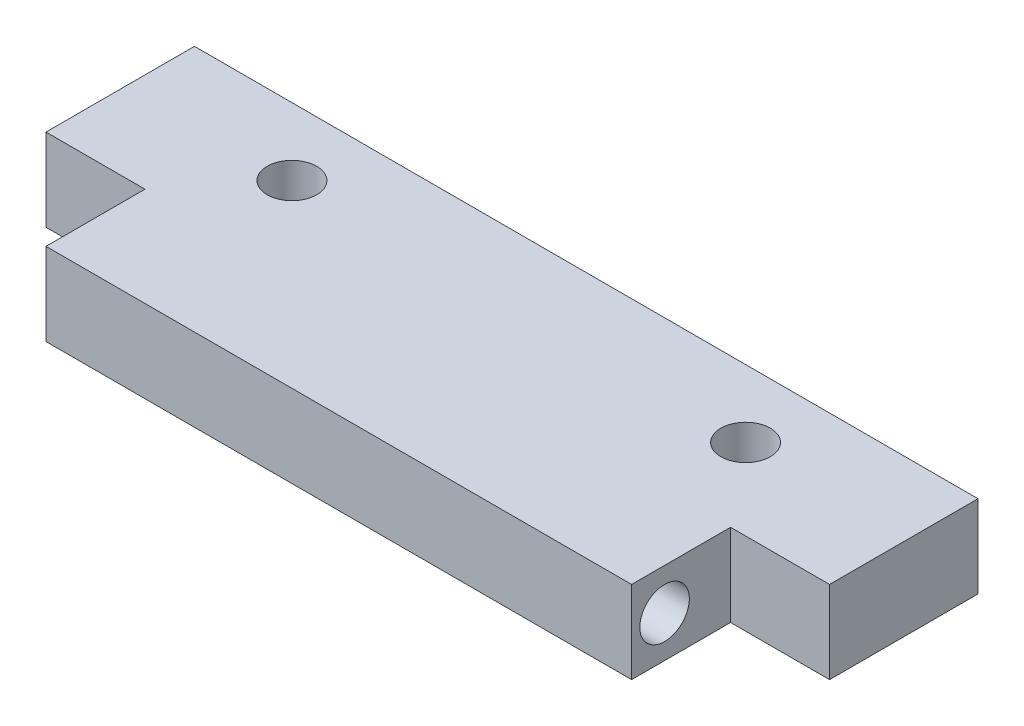
from build123d import *

# Parameters (mm, degrees)
SKETCH2_R           = 1.5
BOSS_EXTRUDE1_DEPTH = 5
SKETCH4_R           = 1.5
CUT_EXTRUDE1_DEPTH  = 51.652969899


with BuildPart() as part:
    # Sketch2 → Boss-Extrude1 (new body)
    with BuildSketch(Plane(origin=(0, 0, 0), x_dir=(1, 0, 0), z_dir=(0, 1, 0))):
        Polygon((-70.88750853, 28.608973411), (-23.38750853, 28.608973411), (-23.38750853, 19.608973411), (-29.38750853, 19.608973411), (-29.38750853, 13.608973411), (-64.88750853, 13.608973411), (-64.88750853, 19.608973411), (-70.88750853, 19.608973411), align=None)
        with Locations(Location((-60.88750853, 24.518639814, 0), (0, 0, 270))):
            Circle(SKETCH2_R, mode=Mode.SUBTRACT)
        with Locations(Location((-33.38750853, 24.518639814, 0), (0, 0, 270))):
            Circle(SKETCH2_R, mode=Mode.SUBTRACT)
    extrude(amount=BOSS_EXTRUDE1_DEPTH)

    # Sketch4 → Cut-Extrude1 (cut, through all)
    with BuildSketch(Plane.ZY.offset(64.88750853)):
        with Locations((-15.608973411, 2.5)):
            Circle(SKETCH4_R)
    extrude(amount=-CUT_EXTRUDE1_DEPTH, mode=Mode.SUBTRACT)


solid = part.part
